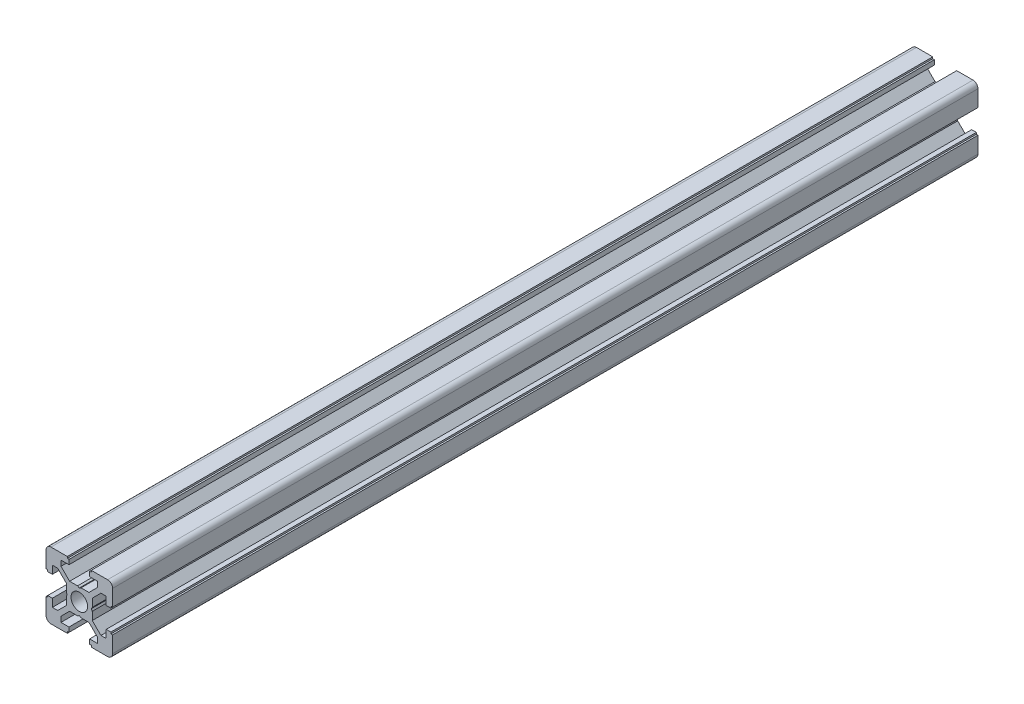
from build123d import *

# Parameters (mm, degrees)
SKETCH_28_R     = 2.5
EXTRUDE_1_DEPTH = 260


with BuildPart() as part:
    # 草图28 → 凸台-拉伸1 (new body)
    with BuildSketch(Plane.XY):
        with BuildLine():
            Line((-3.9, -0.519615242), (-3.9, -2.910050506))
            Line((-3.9, -2.910050506), (-6.489949494, -5.5))
            Line((-6.489949494, -5.5), (-8.1, -5.5))
            Line((-8.1, -5.5), (-8.1, -3.1))
            Line((-8.1, -3.1), (-9.5, -3.1))
            Line((-9.5, -3.1), (-9.5, -3.6))
            Line((-9.5, -3.6), (-10, -3.6))
            Line((-10, -3.6), (-10, -8.5))
            ThreePointArc((-10, -8.5), (-9.560660172, -9.560660172), (-8.5, -10))
            Line((-8.5, -10), (-3.6, -10))
            Line((-3.6, -10), (-3.6, -9.5))
            Line((-3.6, -9.5), (-3.1, -9.5))
            Line((-3.1, -9.5), (-3.1, -8.1))
            Line((-3.1, -8.1), (-5.5, -8.1))
            Line((-5.5, -8.1), (-5.5, -6.489949494))
            Line((-5.5, -6.489949494), (-2.910050506, -3.9))
            Line((-2.910050506, -3.9), (-0.519615242, -3.9))
            Line((-0.519615242, -3.9), (0, -3.6))
            Line((0, -3.6), (0.519615242, -3.9))
            Line((0.519615242, -3.9), (2.910050506, -3.9))
            Line((2.910050506, -3.9), (5.5, -6.489949494))
            Line((5.5, -6.489949494), (5.5, -8.1))
            Line((5.5, -8.1), (3.1, -8.1))
            Line((3.1, -8.1), (3.1, -9.5))
            Line((3.1, -9.5), (3.6, -9.5))
            Line((3.6, -9.5), (3.6, -10))
            Line((3.6, -10), (8.5, -10))
            ThreePointArc((8.5, -10), (9.560660172, -9.560660172), (10, -8.5))
            Line((10, -8.5), (10, -3.6))
            Line((10, -3.6), (9.5, -3.6))
            Line((9.5, -3.6), (9.5, -3.1))
            Line((9.5, -3.1), (8.1, -3.1))
            Line((8.1, -3.1), (8.1, -5.5))
            Line((8.1, -5.5), (6.489949494, -5.5))
            Line((6.489949494, -5.5), (3.9, -2.910050506))
            Line((3.9, -2.910050506), (3.9, -0.519615242))
            Line((3.9, -0.519615242), (3.6, 0))
            Line((3.6, 0), (3.9, 0.519615242))
            Line((3.9, 0.519615242), (3.9, 2.910050506))
            Line((3.9, 2.910050506), (6.489949494, 5.5))
            Line((6.489949494, 5.5), (8.1, 5.5))
            Line((8.1, 5.5), (8.1, 3.1))
            Line((8.1, 3.1), (9.5, 3.1))
            Line((9.5, 3.1), (9.5, 3.6))
            Line((9.5, 3.6), (10, 3.6))
            Line((10, 3.6), (10, 8.5))
            ThreePointArc((10, 8.5), (9.560660172, 9.560660172), (8.5, 10))
            Line((8.5, 10), (3.6, 10))
            Line((3.6, 10), (3.6, 9.5))
            Line((3.6, 9.5), (3.1, 9.5))
            Line((3.1, 9.5), (3.1, 8.1))
            Line((3.1, 8.1), (5.5, 8.1))
            Line((5.5, 8.1), (5.5, 6.489949494))
            Line((5.5, 6.489949494), (2.910050506, 3.9))
            Line((2.910050506, 3.9), (0.519615242, 3.9))
            Line((0.519615242, 3.9), (0, 3.6))
            Line((0, 3.6), (-0.519615242, 3.9))
            Line((-0.519615242, 3.9), (-2.910050506, 3.9))
            Line((-2.910050506, 3.9), (-5.5, 6.489949494))
            Line((-5.5, 6.489949494), (-5.5, 8.1))
            Line((-5.5, 8.1), (-3.1, 8.1))
            Line((-3.1, 8.1), (-3.1, 9.5))
            Line((-3.1, 9.5), (-3.6, 9.5))
            Line((-3.6, 9.5), (-3.6, 10))
            Line((-3.6, 10), (-8.5, 10))
            ThreePointArc((-8.5, 10), (-9.560660172, 9.560660172), (-10, 8.5))
            Line((-10, 8.5), (-10, 3.6))
            Line((-10, 3.6), (-9.5, 3.6))
            Line((-9.5, 3.6), (-9.5, 3.1))
            Line((-9.5, 3.1), (-8.1, 3.1))
            Line((-8.1, 3.1), (-8.1, 5.5))
            Line((-8.1, 5.5), (-6.489949494, 5.5))
            Line((-6.489949494, 5.5), (-3.9, 2.910050506))
            Line((-3.9, 2.910050506), (-3.9, 0.519615242))
            Line((-3.9, 0.519615242), (-3.6, 0))
            Line((-3.6, 0), (-3.9, -0.519615242))
        make_face()
        Circle(SKETCH_28_R, mode=Mode.SUBTRACT)
    extrude(amount=EXTRUDE_1_DEPTH)


solid = part.part
